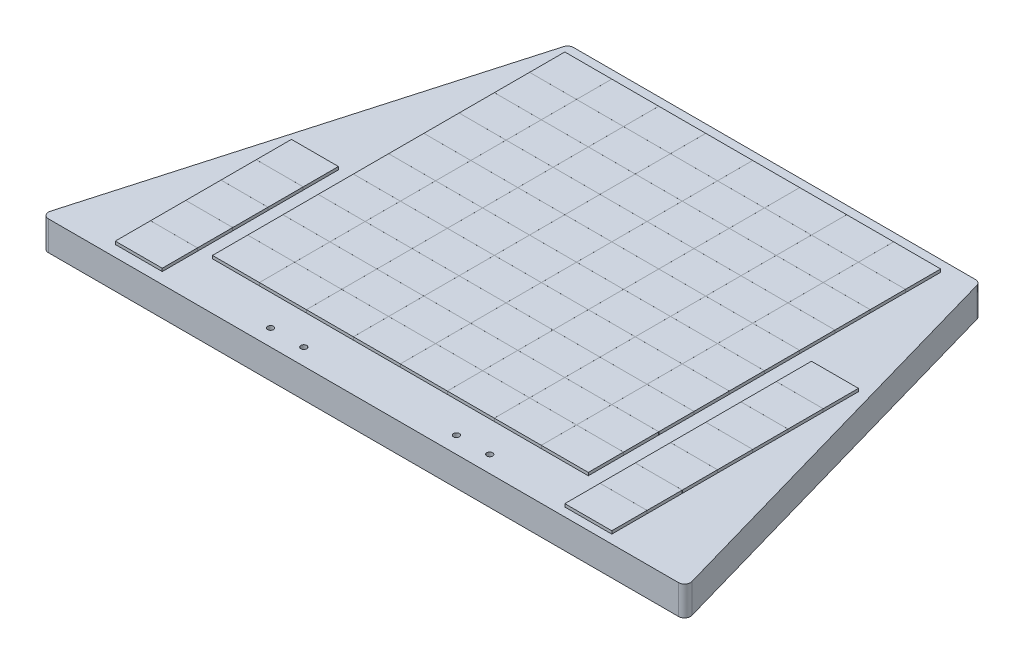
from build123d import *

# Parameters (mm, degrees)
BOSS_EXTRUDE1_DEPTH  = 63.5
SKETCH2_R            = 6.35
CUT_EXTRUDE1_DEPTH   = 1130.820137927
SKETCH3_W            = 101.6
SKETCH3_H            = 76.2
BOSS_EXTRUDE2_DEPTH  = 6.35
LPATTERN1_COUNT      = 8
LPATTERN1_PITCH      = 101.6254
LPATTERN1_COUNT_DIR2 = 10
LPATTERN1_PITCH_DIR2 = 76.2254
SKETCH4_W            = 101.6
SKETCH4_H            = 76.2
BOSS_EXTRUDE3_DEPTH  = 6.35
LPATTERN2_COUNT      = 7
LPATTERN2_PITCH      = 76.2254
SKETCH5_W            = 101.6
SKETCH5_H            = 76.2
BOSS_EXTRUDE4_DEPTH  = 6.35
LPATTERN3_COUNT      = 5
LPATTERN3_PITCH      = 76.2254


with BuildPart() as part:
    # Sketch1 → Boss-Extrude1 (new body)
    with BuildSketch(Plane(origin=(0, 0, 0), x_dir=(1, 0, 0), z_dir=(0, 1, 0))):
        with BuildLine():
            Line((-681.663229201, 0), (681.663229201, 0))
            ThreePointArc((681.663229201, 0), (691.802257032, 5.052116983), (693.874583336, 16.188958324))
            Line((693.874583336, 16.188958324), (447.131726193, 879.788958324))
            ThreePointArc((447.131726193, 879.788958324), (442.568255075, 886.439027831), (434.920372058, 889))
            Line((434.920372058, 889), (-434.920372058, 889))
            ThreePointArc((-434.920372058, 889), (-442.568255075, 886.439027831), (-447.131726193, 879.788958324))
            Line((-447.131726193, 879.788958324), (-693.874583336, 16.188958324))
            ThreePointArc((-693.874583336, 16.188958324), (-691.802257032, 5.052116983), (-681.663229201, 0))
        make_face()
    extrude(amount=BOSS_EXTRUDE1_DEPTH)

    # Sketch2 → Cut-Extrude1 (cut, through all)
    with BuildSketch(Plane(origin=(0, 63.5, 0), x_dir=(1, 0, 0), z_dir=(0, 1, 0))):
        with Locations(Location((-236.982, 35.941, 0), (0, 0, 270))):
            Circle(SKETCH2_R)
        with Locations(Location((-165.1, 35.941, 0), (0, 0, 270))):
            Circle(SKETCH2_R)
        with Locations(Location((165.1, 35.941, 0), (0, 0, 270))):
            Circle(SKETCH2_R)
        with Locations(Location((236.982, 35.941, 0), (0, 0, 270))):
            Circle(SKETCH2_R)
    extrude(amount=-CUT_EXTRUDE1_DEPTH, mode=Mode.SUBTRACT)

    # Sketch3 → Boss-Extrude2 (add)
    with BuildSketch(Plane(origin=(0, 63.5, 0), x_dir=(1, 0, 0), z_dir=(0, 1, 0))):
        with Locations((-378.572700628, 826.652038687)):
            Rectangle(SKETCH3_W, SKETCH3_H)
    boss_extrude2 = extrude(amount=BOSS_EXTRUDE2_DEPTH)

    # LPattern1: Boss-Extrude2 8 × 10
    with Locations(*[(i * LPATTERN1_PITCH, 0, j * LPATTERN1_PITCH_DIR2) for i in range(LPATTERN1_COUNT) for j in range(LPATTERN1_COUNT_DIR2) if (i, j) != (0, 0)]):
        add(boss_extrude2)

    # Sketch4 → Boss-Extrude3 (add)
    with BuildSketch(Plane(origin=(0, 63.5, 0), x_dir=(1, 0, 0), z_dir=(0, 1, 0))):
        with Locations((467.544091786, 56.735246272)):
            Rectangle(SKETCH4_W, SKETCH4_H)
    boss_extrude3 = extrude(amount=BOSS_EXTRUDE3_DEPTH)

    # LPattern2: Boss-Extrude3 ×7
    with Locations(*[(0, 0, -i * LPATTERN2_PITCH) for i in range(1, LPATTERN2_COUNT)]):
        add(boss_extrude3)

    # Sketch5 → Boss-Extrude4 (add)
    with BuildSketch(Plane(origin=(0, 63.5, 0), x_dir=(1, 0, 0), z_dir=(0, 1, 0))):
        with Locations((-510.489418114, 62.347961313)):
            Rectangle(SKETCH5_W, SKETCH5_H)
    boss_extrude4 = extrude(amount=BOSS_EXTRUDE4_DEPTH)

    # LPattern3: Boss-Extrude4 ×5
    with Locations(*[(0, 0, -i * LPATTERN3_PITCH) for i in range(1, LPATTERN3_COUNT)]):
        add(boss_extrude4)


solid = part.part
